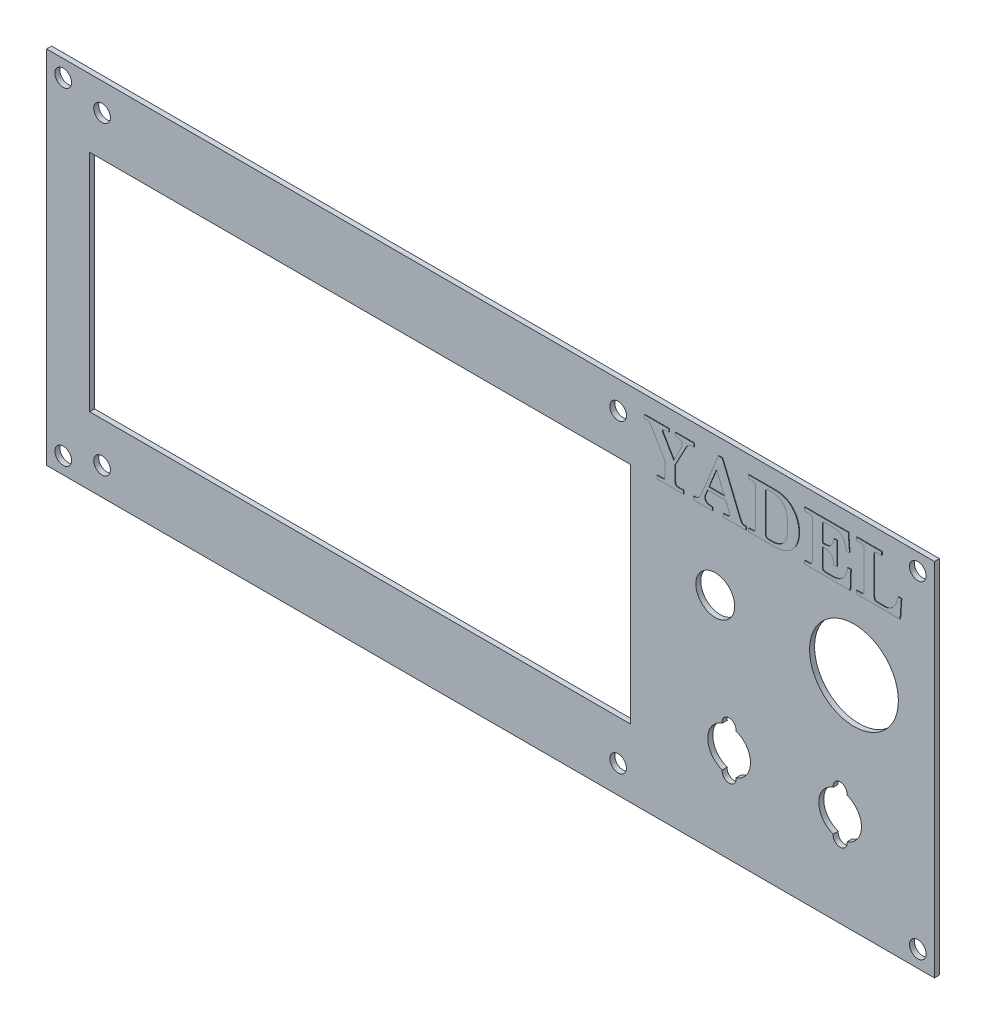
from build123d import *

# Parameters (mm, degrees)
ESQUISSE1_W             = 160
ESQUISSE1_H             = 65
ESQUISSE1_R             = 1.5
BOSS_EXTRU_1_DEPTH      = 0.9
ESQUISSE2_R             = 8
ESQUISSE2_R_2           = 3.5
ESQUISSE2_R_3           = 1.25
ESQUISSE2_R_4           = 3.85
ESQUISSE2_W             = 97.5
ESQUISSE2_H             = 40.5
ESQUISSE2_R_5           = 1.5
ENL_V_MAT_EXTRU_1_DEPTH = 0.9
BOSS_EXTRU_2_DEPTH      = 0.1


with BuildPart() as part:
    # Esquisse1 → Boss.-Extru.1 (new body)
    with BuildSketch(Plane.XY):
        with Locations((80, 32.5)):
            Rectangle(ESQUISSE1_W, ESQUISSE1_H)
        with Locations((3, 62)):
            Circle(ESQUISSE1_R, mode=Mode.SUBTRACT)
        with Locations((3, 3)):
            Circle(ESQUISSE1_R, mode=Mode.SUBTRACT)
        with Locations((157, 3)):
            Circle(ESQUISSE1_R, mode=Mode.SUBTRACT)
        with Locations((157, 62)):
            Circle(ESQUISSE1_R, mode=Mode.SUBTRACT)
    extrude(amount=BOSS_EXTRU_1_DEPTH)

    # Esquisse2 → Enlèv. mat.-Extru.1 (cut)
    with BuildSketch(Plane.XY.offset(0.9)):
        with Locations((145.5, 40)):
            Circle(ESQUISSE2_R)
        with Locations((120.5, 40)):
            Circle(ESQUISSE2_R_2)
        with Locations((123, 13.15)):
            Circle(ESQUISSE2_R_3)
        with Locations((123, 17)):
            Circle(ESQUISSE2_R_4)
        with Locations((123, 20.85)):
            Circle(ESQUISSE2_R_3)
        with Locations((143, 13.15)):
            Circle(ESQUISSE2_R_3)
        with Locations((143, 17)):
            Circle(ESQUISSE2_R_4)
        with Locations((143, 20.85)):
            Circle(ESQUISSE2_R_3)
        with Locations((56.5, 32.5)):
            Rectangle(ESQUISSE2_W, ESQUISSE2_H)
        with Locations((10, 60)):
            Circle(ESQUISSE2_R_5)
        with Locations((10, 5)):
            Circle(ESQUISSE2_R_5)
        with Locations((103, 5)):
            Circle(ESQUISSE2_R_5)
        with Locations((103, 60)):
            Circle(ESQUISSE2_R_5)
    extrude(amount=-ENL_V_MAT_EXTRU_1_DEPTH, mode=Mode.SUBTRACT)

    # Esquisse3 → Boss.-Extru.2 (add)
    # profile 1 of 5: a face of its own
    with BuildSketch(Plane.XY.offset(0.9)):
        with BuildLine():
            Line((107.803249783, 61.878700087), (112.242599826, 61.878700087))
            Line((112.242599826, 61.878700087), (112.242599826, 61.309552645))
            Line((112.242599826, 61.309552645), (111.65033077, 61.309552645))
            add(Edge.make_bspline(
                [(111.65033077, 61.309552645), (111.601702611, 61.308454076), (111.512497697, 61.306438828), (111.389695329, 61.294195269), (111.290815636, 61.267793), (111.213442358, 61.233011403), (111.157163614, 61.187912023), (111.116336773, 61.137443039), (111.091860734, 61.078577306), (111.089493142, 61.037052927), (111.088297672, 61.016085996)],
                knots=[0, 0, 0, 0, 1.649978988, 3.026769637, 4.173115814, 5.108527378, 5.881060813, 6.597094959, 7.291630266, 8, 8, 8, 8], degree=3))
            add(Edge.make_bspline(
                [(111.088297672, 61.016085996), (111.089977515, 60.990502541), (111.093534977, 60.936323583), (111.113788996, 60.852925912), (111.148752249, 60.764295708), (111.180131697, 60.705704348), (111.196791403, 60.674597531)],
                knots=[0, 0, 0, 0, 0.848893184, 1.797730134, 2.830789942, 4, 4, 4, 4], degree=3))
            Line((111.196791403, 60.674597531), (113.151457147, 57.384213885))
            Line((113.151457147, 57.384213885), (114.467610605, 60.062764031))
            add(Edge.make_bspline(
                [(114.467610605, 60.062764031), (114.492308376, 60.116308185), (114.539555902, 60.21873965), (114.592060605, 60.37270507), (114.624057984, 60.519726034), (114.628901276, 60.615763261), (114.631240495, 60.662147431)],
                knots=[0, 0, 0, 0, 1.129148263, 2.160092213, 3.111359234, 4, 4, 4, 4], degree=3))
            add(Edge.make_bspline(
                [(114.631240495, 60.662147431), (114.628890225, 60.709960902), (114.624339537, 60.802539302), (114.577744453, 60.933247792), (114.500488055, 61.046231285), (114.394335627, 61.141897185), (114.259129041, 61.219788045), (114.093304867, 61.273166228), (113.897871595, 61.30454599), (113.758086441, 61.307806939), (113.683254288, 61.309552645)],
                knots=[0, 0, 0, 0, 0.884200254, 1.7120247, 2.535601234, 3.399669589, 4.34091696, 5.408595814, 6.612725681, 8, 8, 8, 8], degree=3))
            Line((113.683254288, 61.309552645), (113.380894709, 61.309552645))
            Line((113.380894709, 61.309552645), (113.380894709, 61.878700087))
            Line((113.380894709, 61.878700087), (116.795779358, 61.878700087))
            Line((116.795779358, 61.878700087), (116.795779358, 61.309552645))
            add(Edge.make_bspline(
                [(116.795779358, 61.309552645), (116.701864753, 61.305341496), (116.522933112, 61.297318167), (116.269410451, 61.249598245), (116.04271407, 61.181142313), (115.843132279, 61.078738008), (115.667196786, 60.944949669), (115.50647049, 60.77975143), (115.361006002, 60.579660238), (115.279838525, 60.429026345), (115.237738237, 60.350894924)],
                knots=[0, 0, 0, 0, 1.158631572, 2.207493144, 3.17456629, 4.071024185, 4.959115416, 5.890271789, 6.905717302, 8, 8, 8, 8], degree=3))
            Line((115.237738237, 60.350894924), (113.380894709, 56.838188058))
            Line((113.380894709, 56.838188058), (113.380894709, 54.054701352))
            add(Edge.make_bspline(
                [(113.380894709, 54.054701352), (113.382450672, 54.016000693), (113.385361202, 53.943608619), (113.410841916, 53.841847127), (113.452890241, 53.755385318), (113.513981536, 53.684544285), (113.594580242, 53.631287025), (113.69389748, 53.595560179), (113.8113998, 53.571852385), (113.895956035, 53.570089604), (113.941149222, 53.569147441)],
                knots=[0, 0, 0, 0, 1.088641102, 2.036373277, 2.932535239, 3.772977452, 4.639074189, 5.622189685, 6.729120018, 8, 8, 8, 8], degree=3))
            Line((113.941149222, 53.569147441), (114.860678057, 53.569147441))
            Line((114.860678057, 53.569147441), (114.860678057, 53))
            Line((114.860678057, 53), (110.079839549, 53))
            Line((110.079839549, 53), (110.079839549, 53.569147441))
            Line((110.079839549, 53.569147441), (110.994032627, 53.569147441))
            add(Edge.make_bspline(
                [(110.994032627, 53.569147441), (111.042106523, 53.570407346), (111.131696362, 53.572755286), (111.255430941, 53.592110108), (111.35552508, 53.62969708), (111.436075692, 53.68037011), (111.492597003, 53.752026332), (111.531736013, 53.838730773), (111.557208899, 53.94122924), (111.558786931, 54.015406048), (111.559622897, 54.054701352)],
                knots=[0, 0, 0, 0, 1.33431287, 2.486606761, 3.455237023, 4.285744345, 5.09261012, 5.946421484, 6.912112891, 8, 8, 8, 8], degree=3))
            Line((111.559622897, 54.054701352), (111.559622897, 56.528714137))
            Line((111.559622897, 56.528714137), (109.124738999, 60.626575716))
            add(Edge.make_bspline(
                [(109.124738999, 60.626575716), (109.087572878, 60.687978254), (109.016957941, 60.804641934), (108.895744566, 60.955835012), (108.773093192, 61.078123095), (108.642460107, 61.169434934), (108.500782074, 61.231277161), (108.347833512, 61.279040524), (108.177611233, 61.304739401), (108.058850731, 61.307906366), (107.99711563, 61.309552645)],
                knots=[0, 0, 0, 0, 1.231026377, 2.338927208, 3.317810476, 4.195831411, 5.056695332, 5.961387997, 6.940271265, 8, 8, 8, 8], degree=3))
            Line((107.99711563, 61.309552645), (107.803249783, 61.309552645))
            Line((107.803249783, 61.309552645), (107.803249783, 61.878700087))
        make_face()
    # profile 2 of 5: a face of its own
    with BuildSketch(Plane.XY.offset(0.9)):
        with BuildLine():
            Line((121.859413001, 62.106359063), (125.140903719, 54.134737711))
            add(Edge.make_bspline(
                [(125.140903719, 54.134737711), (125.162535864, 54.083929074), (125.202785299, 53.989392963), (125.272202564, 53.863025172), (125.344303077, 53.762426456), (125.42126125, 53.684604499), (125.508914365, 53.631091386), (125.606720225, 53.596891276), (125.715335168, 53.571871939), (125.792295276, 53.570086513), (125.832773577, 53.569147441)],
                knots=[0, 0, 0, 0, 1.370087271, 2.549226437, 3.57052343, 4.434214329, 5.246883247, 6.094249163, 6.997642324, 8, 8, 8, 8], degree=3))
            Line((125.832773577, 53.569147441), (126.129797398, 53.569147441))
            Line((126.129797398, 53.569147441), (126.129797398, 53))
            Line((126.129797398, 53), (122.03193582, 53))
            Line((122.03193582, 53), (122.03193582, 53.569147441))
            Line((122.03193582, 53.569147441), (122.416110343, 53.569147441))
            add(Edge.make_bspline(
                [(122.416110343, 53.569147441), (122.48608359, 53.570657513), (122.613848884, 53.573414776), (122.788842894, 53.589010359), (122.928078404, 53.620160562), (123.037351269, 53.661354147), (123.114383296, 53.719874955), (123.172272171, 53.781730339), (123.207211497, 53.855311027), (123.210994025, 53.9073202), (123.212916761, 53.933757521)],
                knots=[0, 0, 0, 0, 1.734001692, 3.166141951, 4.34179556, 5.263658256, 6.030315746, 6.716978054, 7.34781383, 8, 8, 8, 8], degree=3))
            add(Edge.make_bspline(
                [(123.212916761, 53.933757521), (123.209041763, 53.981061112), (123.200550254, 54.084720225), (123.162473963, 54.181644478), (123.14177333, 54.234338514)],
                knots=[0, 0, 0, 0, 0.912675961, 2, 2, 2, 2], degree=3))
            Line((123.14177333, 54.234338514), (122.48013943, 55.845737207))
            Line((122.48013943, 55.845737207), (119.219991742, 55.845737207))
            Line((119.219991742, 55.845737207), (118.921189335, 55.111181291))
            add(Edge.make_bspline(
                [(118.921189335, 55.111181291), (118.89119412, 55.039792722), (118.835985996, 54.908397465), (118.773210428, 54.722663571), (118.731754445, 54.566344834), (118.724976238, 54.470473829), (118.72198773, 54.428204361)],
                knots=[0, 0, 0, 0, 1.298659012, 2.390265557, 3.29026905, 4, 4, 4, 4], degree=3))
            add(Edge.make_bspline(
                [(118.72198773, 54.428204361), (118.725054075, 54.367274683), (118.731053374, 54.248065854), (118.788640404, 54.079236901), (118.882025026, 53.92864631), (119.012600607, 53.800652641), (119.172685927, 53.6948607), (119.363594012, 53.623044711), (119.578086465, 53.575182324), (119.730749158, 53.57121796), (119.810482212, 53.569147441)],
                knots=[0, 0, 0, 0, 0.936681703, 1.832616438, 2.715165993, 3.645764122, 4.629294347, 5.650980637, 6.773148287, 8, 8, 8, 8], degree=3))
            Line((119.810482212, 53.569147441), (120.096834519, 53.569147441))
            Line((120.096834519, 53.569147441), (120.096834519, 53))
            Line((120.096834519, 53), (116.68194987, 53))
            Line((116.68194987, 53), (116.68194987, 53.569147441))
            Line((116.68194987, 53.569147441), (116.886487232, 53.569147441))
            add(Edge.make_bspline(
                [(116.886487232, 53.569147441), (116.94245459, 53.571393839), (117.052139405, 53.575796329), (117.210689924, 53.61484444), (117.359549915, 53.676555233), (117.447114546, 53.737607236), (117.491206388, 53.768349046)],
                knots=[0, 0, 0, 0, 1.034931053, 2.028257604, 3.007159006, 4, 4, 4, 4], degree=3))
            add(Edge.make_bspline(
                [(117.491206388, 53.768349046), (117.550618664, 53.817331564), (117.669365499, 53.915232526), (117.824637524, 54.088261488), (117.959252194, 54.280679111), (118.030007987, 54.421312909), (118.065689587, 54.492233448)],
                knots=[0, 0, 0, 0, 0.989267864, 1.977241644, 2.979938569, 4, 4, 4, 4], degree=3))
            Line((118.065689587, 54.492233448), (121.153314457, 62.106359063))
            Line((121.153314457, 62.106359063), (121.859413001, 62.106359063))
        make_face()
        Polygon((120.836726192, 59.835105055), (119.449429304, 56.414884649), (122.24536611, 56.414884649), align=None, mode=Mode.SUBTRACT)
    # profile 3 of 5: a face of its own
    with BuildSketch(Plane.XY.offset(0.9)):
        with BuildLine():
            Line((126.585115351, 61.878700087), (131.33216073, 61.878700087))
            add(Edge.make_bspline(
                [(131.33216073, 61.878700087), (131.438321406, 61.87681702), (131.647970502, 61.873098287), (131.957649382, 61.848867085), (132.256807448, 61.803695047), (132.545937995, 61.742945439), (132.826063483, 61.667894174), (133.094949566, 61.570136838), (133.355389279, 61.459057376), (133.604603323, 61.328544147), (133.841808453, 61.182935297), (134.068647699, 61.024527887), (134.278792715, 60.847322999), (134.479953208, 60.659308332), (134.663866586, 60.453965853), (134.836922412, 60.235656328), (134.993405232, 60.000678235), (135.140426317, 59.754147061), (135.268513023, 59.494704027), (135.384271337, 59.227922476), (135.476999571, 58.951184082), (135.556615149, 58.667762558), (135.616040134, 58.375137674), (135.661490976, 58.074915097), (135.685839128, 57.766423441), (135.689583509, 57.558552944), (135.691474415, 57.453578729)],
                knots=[0, 0, 0, 0, 1.095124878, 2.162683496, 3.201422963, 4.213739968, 5.209254947, 6.189989335, 7.162451537, 8.128043583, 9.088801183, 10.032215269, 10.978894355, 11.921971404, 12.870209753, 13.819610945, 14.793226264, 15.780195082, 16.778467595, 17.775821777, 18.777628539, 19.786559333, 20.810849883, 21.85563876, 22.91710156, 24, 24, 24, 24], degree=3))
            add(Edge.make_bspline(
                [(135.691474415, 57.453578729), (135.690499242, 57.345025691), (135.688578151, 57.131175962), (135.661659508, 56.815514135), (135.624008542, 56.510127864), (135.568549285, 56.215549819), (135.497542022, 55.932157937), (135.41038442, 55.659392169), (135.30700111, 55.397379189), (135.188327209, 55.146158012), (135.051867904, 54.907596451), (134.903705115, 54.679059197), (134.736309935, 54.465015503), (134.555833155, 54.261576653), (134.356327981, 54.072976845), (134.143721076, 53.894194511), (133.912536075, 53.731516272), (133.670620392, 53.578470502), (133.417922425, 53.442632354), (133.158760297, 53.324669441), (132.894978697, 53.224804938), (132.625832894, 53.142759915), (132.351860883, 53.078963291), (132.07338285, 53.032083076), (131.790386823, 53.00521641), (131.600189063, 53.001743753), (131.504683548, 53)],
                knots=[0, 0, 0, 0, 1.13887174, 2.243579878, 3.322457727, 4.367025756, 5.387125682, 6.38669751, 7.369928061, 8.341215495, 9.299704588, 10.252278776, 11.196874661, 12.148635726, 13.103584326, 14.075469414, 15.061295075, 16.067717662, 17.078228411, 18.069458256, 19.054006876, 20.036134399, 21.020132398, 22.004130398, 22.997798122, 24, 24, 24, 24], degree=3))
            Line((131.504683548, 53), (126.585115351, 53))
            Line((126.585115351, 53), (126.585115351, 53.569147441))
            Line((126.585115351, 53.569147441), (127.305442582, 53.569147441))
            add(Edge.make_bspline(
                [(127.305442582, 53.569147441), (127.346560569, 53.570476021), (127.425160603, 53.573015698), (127.534219825, 53.602278963), (127.629073624, 53.646549124), (127.705723592, 53.712873909), (127.763912204, 53.796087175), (127.808213822, 53.892827569), (127.83220402, 54.004947778), (127.835506684, 54.084238035), (127.837239722, 54.125844783)],
                knots=[0, 0, 0, 0, 1.122856504, 2.146422164, 3.068293037, 3.966132366, 4.88499783, 5.829313612, 6.860954614, 8, 8, 8, 8], degree=3))
            Line((127.837239722, 54.125844783), (127.837239722, 60.795541362))
            add(Edge.make_bspline(
                [(127.837239722, 60.795541362), (127.835733265, 60.837199959), (127.832878367, 60.916147497), (127.806700897, 61.025078826), (127.76321462, 61.117336954), (127.69895409, 61.19111937), (127.611784666, 61.24619875), (127.503146024, 61.284189187), (127.370984442, 61.306776423), (127.275306715, 61.308579005), (127.223627637, 61.309552645)],
                knots=[0, 0, 0, 0, 1.078064526, 2.043048672, 2.881216632, 3.697706621, 4.541346901, 5.523059816, 6.66211301, 8, 8, 8, 8], degree=3))
            Line((127.223627637, 61.309552645), (126.585115351, 61.309552645))
            Line((126.585115351, 61.309552645), (126.585115351, 61.878700087))
        make_face()
        with BuildLine():
            add(Edge.make_bspline(
                [(130.87150702, 53.569147441), (130.942103536, 53.570597949), (131.081196281, 53.57345581), (131.2867536, 53.593606596), (131.486337708, 53.625608918), (131.680486025, 53.669314213), (131.867481591, 53.728584941), (132.048111305, 53.800041593), (132.222720683, 53.884032263), (132.39163419, 53.979224818), (132.550693079, 54.088072693), (132.701248422, 54.204785112), (132.837438618, 54.333399004), (132.963617642, 54.469479161), (133.077686916, 54.615956106), (133.180194656, 54.771968219), (133.272185694, 54.936786065), (133.351182933, 55.114367518), (133.421060519, 55.308612053), (133.481756543, 55.524821318), (133.529917416, 55.766515236), (133.573050965, 56.031542197), (133.604012795, 56.321920845), (133.627452789, 56.636272789), (133.638675609, 56.975652517), (133.641226541, 57.209907123), (133.642543625, 57.330856312)],
                knots=[0, 0, 0, 0, 0.949765025, 1.871273987, 2.776130108, 3.66816782, 4.546113786, 5.412643397, 6.279613467, 7.151267918, 8.018531503, 8.870659598, 9.711550513, 10.535742305, 11.365473911, 12.206175636, 13.045248569, 13.902142185, 14.818075952, 15.820638119, 16.9204126, 18.132138158, 19.432318017, 20.847999306, 22.372574464, 24, 24, 24, 24], degree=3))
            add(Edge.make_bspline(
                [(133.642543625, 57.330856312), (133.641605549, 57.458935017), (133.639785073, 57.707490608), (133.623323244, 58.068710253), (133.598152545, 58.407104721), (133.557798248, 58.721867622), (133.512181276, 59.013959785), (133.450035759, 59.28172003), (133.38289792, 59.528088898), (133.299907286, 59.751492448), (133.208521725, 59.955323638), (133.110799823, 60.143576216), (133.003728371, 60.316117872), (132.890343836, 60.47475776), (132.769290753, 60.618482976), (132.63843432, 60.744753644), (132.501748146, 60.857680777), (132.355059039, 60.955220184), (132.195682267, 61.040287115), (132.01986428, 61.11268233), (131.826442846, 61.171866601), (131.617289724, 61.224702329), (131.390047413, 61.262895425), (131.145243668, 61.288168032), (130.883664312, 61.307411531), (130.703173229, 61.308823954), (130.610054914, 61.309552645)],
                knots=[0, 0, 0, 0, 1.586297713, 3.07844435, 4.478005486, 5.787764439, 7.008271247, 8.137702286, 9.190763021, 10.168851427, 11.085936446, 11.956353167, 12.7939037, 13.598887414, 14.369895025, 15.117682938, 15.848254541, 16.563120313, 17.29571888, 18.082579543, 18.914023681, 19.799183864, 20.752903796, 21.764942868, 22.846897305, 24, 24, 24, 24], degree=3))
            add(Edge.make_bspline(
                [(130.610054914, 61.309552645), (130.559653367, 61.309311796), (130.464154932, 61.308855445), (130.327803952, 61.302785109), (130.206737426, 61.296552579), (130.099710787, 61.286501886), (130.008381638, 61.2704324), (129.931288048, 61.252504611), (129.867530733, 61.234603918), (129.804709566, 61.201857994), (129.742755818, 61.148202173), (129.691590338, 61.062457977), (129.664420065, 60.955422028), (129.660580073, 60.878100568), (129.658511535, 60.836448835)],
                knots=[0, 0, 0, 0, 1.479388087, 2.803073613, 4.005921637, 5.038015802, 5.956445119, 6.724759669, 7.363251975, 7.892554548, 8.792999824, 9.730199517, 10.777297743, 12, 12, 12, 12], degree=3))
            Line((129.658511535, 60.836448835), (129.658511535, 54.132959126))
            add(Edge.make_bspline(
                [(129.658511535, 54.132959126), (129.660286774, 54.086042649), (129.663570601, 53.999256793), (129.685367013, 53.878298377), (129.726337517, 53.779038407), (129.782570602, 53.697842053), (129.860428709, 53.638323542), (129.95614171, 53.598983755), (130.069843102, 53.573403707), (130.151611432, 53.57063722), (130.195644433, 53.569147441)],
                knots=[0, 0, 0, 0, 1.25011308, 2.312452742, 3.253936465, 4.091094141, 4.912462066, 5.824887263, 6.828681705, 8, 8, 8, 8], degree=3))
            Line((130.195644433, 53.569147441), (130.87150702, 53.569147441))
        make_face(mode=Mode.SUBTRACT)
    # profile 4 of 5: a face of its own
    with BuildSketch(Plane.XY.offset(0.9)):
        with BuildLine():
            Line((136.715939809, 61.878700087), (144.570174501, 61.878700087))
            Line((144.570174501, 61.878700087), (144.797833478, 58.805303903))
            Line((144.797833478, 58.805303903), (144.228686037, 58.805303903))
            add(Edge.make_bspline(
                [(144.228686037, 58.805303903), (144.212588181, 58.892551357), (144.181508387, 59.060998189), (144.128422817, 59.303109826), (144.070592467, 59.525709853), (144.01401275, 59.73084529), (143.948413154, 59.914871174), (143.885947364, 60.08243173), (143.816442696, 60.229318553), (143.722792545, 60.399156863), (143.59085712, 60.586037357), (143.409396962, 60.781239268), (143.203197532, 60.94495168), (142.973863208, 61.081529396), (142.71257191, 61.184713903), (142.418000851, 61.258714845), (142.087406374, 61.302734743), (141.855008005, 61.307209683), (141.733330223, 61.309552645)],
                knots=[0, 0, 0, 0, 1.072076736, 2.069836117, 2.994244358, 3.851381349, 4.639837713, 5.354288182, 6.011291753, 6.60137414, 7.696564963, 8.766053296, 9.811074081, 10.867743878, 11.979932002, 13.192784047, 14.530214239, 16, 16, 16, 16], degree=3))
            Line((141.733330223, 61.309552645), (140.463419994, 61.309552645))
            add(Edge.make_bspline(
                [(140.463419994, 61.309552645), (140.417106415, 61.308219846), (140.331116005, 61.305745238), (140.212194902, 61.287311673), (140.113182328, 61.254113714), (140.034857805, 61.205577245), (139.974877382, 61.144437829), (139.934124998, 61.071830171), (139.907759335, 60.988796864), (139.904748402, 60.929744572), (139.903165481, 60.898699336)],
                knots=[0, 0, 0, 0, 1.405644672, 2.609860082, 3.640124863, 4.553926833, 5.381221799, 6.211643069, 7.059816985, 8, 8, 8, 8], degree=3))
            Line((139.903165481, 60.898699336), (139.903165481, 57.894667997))
            Line((139.903165481, 57.894667997), (140.330026063, 57.894667997))
            add(Edge.make_bspline(
                [(140.330026063, 57.894667997), (140.3899389, 57.896279236), (140.505882918, 57.899397325), (140.675092395, 57.916468623), (140.833844464, 57.949028959), (140.983064857, 57.992594837), (141.121398282, 58.049931035), (141.248796623, 58.120045014), (141.366676554, 58.201817293), (141.474549271, 58.296898199), (141.571715903, 58.406532649), (141.657044595, 58.532672852), (141.733238307, 58.673243312), (141.799799494, 58.828934147), (141.851977218, 59.001133707), (141.895826239, 59.187736448), (141.932784331, 59.389371669), (141.945517133, 59.529635113), (141.952096271, 59.602110321)],
                knots=[0, 0, 0, 0, 1.081249572, 2.09244671, 3.06376056, 4.001264571, 4.893234814, 5.759762344, 6.620327001, 7.476692944, 8.348158368, 9.256085728, 10.218226265, 11.229536556, 12.305428516, 13.460016981, 14.687571108, 16, 16, 16, 16], degree=3))
            Line((141.952096271, 59.602110321), (142.521243712, 59.602110321))
            Line((142.521243712, 59.602110321), (142.521243712, 55.504248742))
            Line((142.521243712, 55.504248742), (141.952096271, 55.504248742))
            add(Edge.make_bspline(
                [(141.952096271, 55.504248742), (141.946506981, 55.584968338), (141.935750061, 55.740317995), (141.90528339, 55.96301937), (141.865246934, 56.167825643), (141.811581638, 56.353560567), (141.750666791, 56.522503951), (141.675554372, 56.671920794), (141.587893854, 56.801914935), (141.49111291, 56.916543473), (141.380344937, 57.013991278), (141.257147632, 57.096784997), (141.122640673, 57.16974142), (140.973046308, 57.225340942), (140.812174769, 57.271971065), (140.637622411, 57.303908615), (140.450713, 57.320736592), (140.321758001, 57.323893989), (140.255325461, 57.325520555)],
                knots=[0, 0, 0, 0, 1.36267904, 2.622556782, 3.784025089, 4.874631183, 5.876381068, 6.805394682, 7.683463336, 8.512150666, 9.325776323, 10.159563316, 11.008465503, 11.896867056, 12.842059005, 13.827344498, 14.880733395, 16, 16, 16, 16], degree=3))
            Line((140.255325461, 57.325520555), (139.903165481, 57.325520555))
            Line((139.903165481, 57.325520555), (139.903165481, 54.012015294))
            add(Edge.make_bspline(
                [(139.903165481, 54.012015294), (139.904955544, 53.978080811), (139.90830136, 53.914653667), (139.930580715, 53.826483061), (139.971966265, 53.753301462), (140.012873137, 53.719281585), (140.033002242, 53.702541373)],
                knots=[0, 0, 0, 0, 1.167205204, 2.181630186, 3.105232066, 4, 4, 4, 4], degree=3))
            add(Edge.make_bspline(
                [(140.033002242, 53.702541373), (140.06907346, 53.681441255), (140.144942725, 53.637060985), (140.280607956, 53.598746537), (140.435190999, 53.573849064), (140.545703006, 53.570769805), (140.603928269, 53.569147441)],
                knots=[0, 0, 0, 0, 0.841207128, 1.769326616, 2.82472911, 4, 4, 4, 4], degree=3))
            Line((140.603928269, 53.569147441), (141.708430022, 53.569147441))
            add(Edge.make_bspline(
                [(141.708430022, 53.569147441), (141.801018773, 53.571071008), (141.982030033, 53.574831585), (142.24738686, 53.608018709), (142.500060278, 53.660320296), (142.739132504, 53.735770764), (142.965892063, 53.829656205), (143.177535935, 53.948532102), (143.3788204, 54.085737625), (143.565528431, 54.24612186), (143.737130033, 54.428643388), (143.892094549, 54.632799452), (144.031783647, 54.857173653), (144.150145663, 55.104934688), (144.253739256, 55.37308431), (144.339959071, 55.662753002), (144.410384191, 55.974051292), (144.440724321, 56.189916441), (144.456345013, 56.30105516)],
                knots=[0, 0, 0, 0, 1.031571464, 2.016725019, 2.975737277, 3.90365013, 4.806884149, 5.706048434, 6.604143789, 7.517950739, 8.443507882, 9.391092695, 10.370289309, 11.38394948, 12.446627214, 13.571304651, 14.749580046, 16, 16, 16, 16], degree=3))
            Line((144.456345013, 56.30105516), (145.025492455, 56.30105516))
            Line((145.025492455, 56.30105516), (144.911662966, 53))
            Line((144.911662966, 53), (136.715939809, 53))
            Line((136.715939809, 53), (136.715939809, 53.569147441))
            Line((136.715939809, 53.569147441), (137.523417742, 53.569147441))
            add(Edge.make_bspline(
                [(137.523417742, 53.569147441), (137.566203134, 53.570909981), (137.647825752, 53.574272415), (137.762395887, 53.597721319), (137.860579328, 53.641814955), (137.941511247, 53.702594461), (138.005089126, 53.778955786), (138.050181578, 53.868335401), (138.077269829, 53.969546614), (138.080316665, 54.040894301), (138.081893669, 54.077822967)],
                knots=[0, 0, 0, 0, 1.197590393, 2.284669081, 3.25007612, 4.18594059, 5.093121875, 6.005900763, 6.967879297, 8, 8, 8, 8], degree=3))
            Line((138.081893669, 54.077822967), (138.081893669, 60.889806407))
            add(Edge.make_bspline(
                [(138.081893669, 60.889806407), (138.080377897, 60.923775496), (138.07750462, 60.988166876), (138.050976092, 61.077839875), (138.004258823, 61.152096631), (137.93935673, 61.214100281), (137.848448937, 61.258555355), (137.732190269, 61.289694017), (137.587841276, 61.305110027), (137.482535473, 61.307993514), (137.425595525, 61.309552645)],
                knots=[0, 0, 0, 0, 0.911783951, 1.72836626, 2.480019639, 3.246558688, 4.108965725, 5.168374927, 6.468910761, 8, 8, 8, 8], degree=3))
            Line((137.425595525, 61.309552645), (136.715939809, 61.309552645))
            Line((136.715939809, 61.309552645), (136.715939809, 61.878700087))
        make_face()
    # profile 5 of 5: a face of its own
    with BuildSketch(Plane.XY.offset(0.9)):
        with BuildLine():
            Line((146.049957849, 61.309552645), (146.049957849, 61.878700087))
            Line((146.049957849, 61.878700087), (150.603137381, 61.878700087))
            Line((150.603137381, 61.878700087), (150.603137381, 61.309552645))
            Line((150.603137381, 61.309552645), (149.833009749, 61.309552645))
            add(Edge.make_bspline(
                [(149.833009749, 61.309552645), (149.781864979, 61.308854159), (149.687146487, 61.307560585), (149.557297822, 61.281744227), (149.4499292, 61.245214442), (149.366002164, 61.187682764), (149.3074262, 61.110136592), (149.265847698, 61.015941041), (149.241842765, 60.902234754), (149.238806875, 60.819967125), (149.237183521, 60.775976919)],
                knots=[0, 0, 0, 0, 1.317174052, 2.439364582, 3.40274332, 4.226216974, 5.021934816, 5.877883306, 6.86526021, 8, 8, 8, 8], degree=3))
            Line((149.237183521, 60.775976919), (149.237183521, 54.191652456))
            add(Edge.make_bspline(
                [(149.237183521, 54.191652456), (149.237829724, 54.13106144), (149.239002536, 54.021093116), (149.263694472, 53.873669923), (149.299905132, 53.759605677), (149.359251947, 53.671945142), (149.459276706, 53.622700639), (149.590577478, 53.592836766), (149.763644227, 53.571754638), (149.892823807, 53.570078874), (149.964625095, 53.569147441)],
                knots=[0, 0, 0, 0, 1.253318516, 2.274682744, 3.08242206, 3.723352428, 4.399534733, 5.325689848, 6.513550565, 8, 8, 8, 8], degree=3))
            Line((149.964625095, 53.569147441), (151.257656939, 53.569147441))
            add(Edge.make_bspline(
                [(151.257656939, 53.569147441), (151.317673579, 53.571280521), (151.437274391, 53.575531309), (151.61430279, 53.607372225), (151.788840919, 53.656108051), (151.957683626, 53.731788461), (152.126313471, 53.821630238), (152.289778394, 53.935121779), (152.450788448, 54.067942073), (152.608876717, 54.22038074), (152.761218914, 54.395674312), (152.903318682, 54.596228668), (153.036636922, 54.821285118), (153.160483827, 55.070740155), (153.275679019, 55.34355106), (153.383226665, 55.640005111), (153.477818966, 55.961979086), (153.533859222, 56.185833539), (153.562704077, 56.30105516)],
                knots=[0, 0, 0, 0, 0.746952398, 1.488522408, 2.233867827, 2.997739128, 3.787258218, 4.610437708, 5.470623944, 6.384302497, 7.342016262, 8.35813022, 9.440650158, 10.596202486, 11.823439516, 13.126538548, 14.520981459, 16, 16, 16, 16], degree=3))
            Line((153.562704077, 56.30105516), (154.131851518, 56.30105516))
            Line((154.131851518, 56.30105516), (153.904192541, 53))
            Line((153.904192541, 53), (146.049957849, 53))
            Line((146.049957849, 53), (146.049957849, 53.569147441))
            Line((146.049957849, 53.569147441), (146.868107296, 53.569147441))
            add(Edge.make_bspline(
                [(146.868107296, 53.569147441), (146.910309639, 53.570872766), (146.990777842, 53.574162484), (147.103270577, 53.59800551), (147.199215657, 53.640189043), (147.279775951, 53.697052447), (147.340437675, 53.772481154), (147.386953842, 53.859474986), (147.410870884, 53.962180233), (147.414173007, 54.034439687), (147.415911709, 54.07248721)],
                knots=[0, 0, 0, 0, 1.195528741, 2.279542841, 3.234602015, 4.14844858, 5.043106676, 5.952155301, 6.921726988, 8, 8, 8, 8], degree=3))
            Line((147.415911709, 54.07248721), (147.415911709, 60.841784592))
            add(Edge.make_bspline(
                [(147.415911709, 60.841784592), (147.414415825, 60.879896036), (147.411591513, 60.951852577), (147.385194154, 61.051806792), (147.339699032, 61.135339279), (147.274098746, 61.202451288), (147.186705832, 61.253679574), (147.074407509, 61.285196568), (146.938881675, 61.306500214), (146.839756249, 61.308483142), (146.786292352, 61.309552645)],
                knots=[0, 0, 0, 0, 1.00990991, 1.906766507, 2.716615905, 3.506507968, 4.367174043, 5.37229384, 6.582730811, 8, 8, 8, 8], degree=3))
            Line((146.786292352, 61.309552645), (146.049957849, 61.309552645))
        make_face()
    extrude(amount=BOSS_EXTRU_2_DEPTH)


solid = part.part
